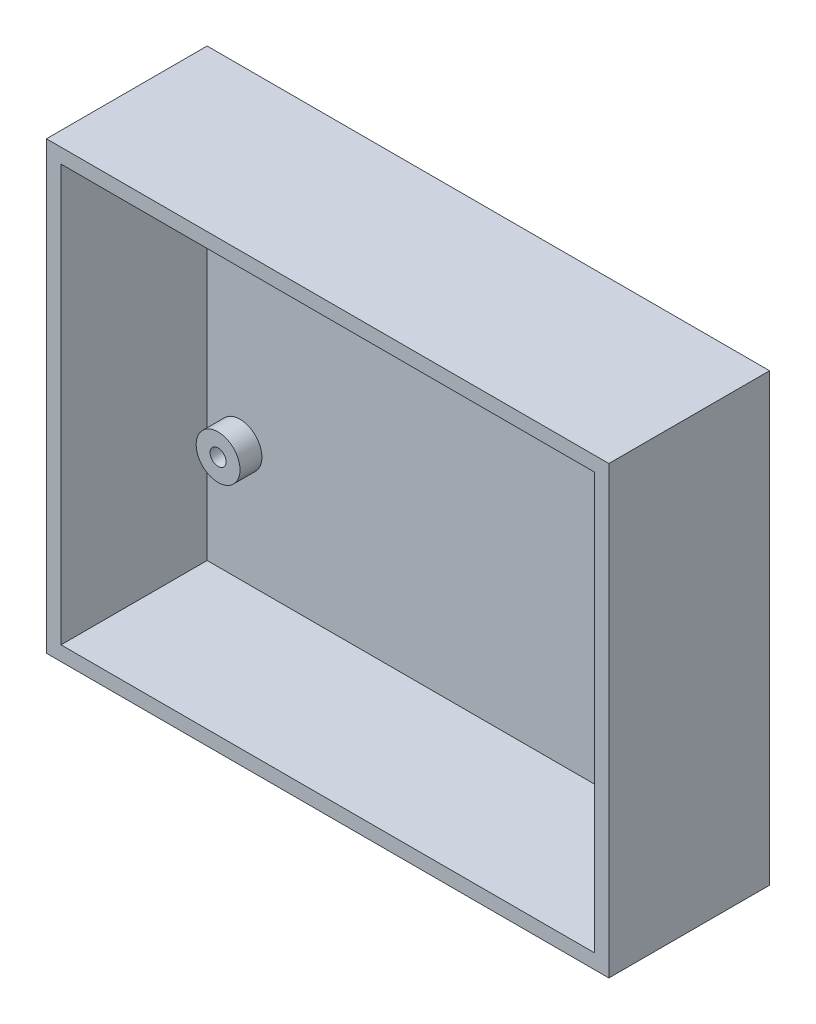
from build123d import *

# Parameters (mm, degrees)
SKETCH_1_W          = 77
SKETCH_1_H          = 61
EXTRUDE_1_DEPTH     = 22
SKETCH_2_W          = 73
SKETCH_2_H          = 57
CUT_EXTRUDE_1_DEPTH = 101.667770413
SKETCH_3_W          = 77
SKETCH_3_H          = 61
EXTRUDE_2_DEPTH     = 2
SKETCH_4_R          = 3
EXTRUDE_3_DEPTH     = 5
SKETCH_5_R          = 1.1
CUT_EXTRUDE_2_DEPTH = 101.667770413


with BuildPart() as part:
    # 草图1 → 凸台-拉伸1 (new body)
    with BuildSketch(Plane.XY):
        with Locations((38.5, 30.5)):
            Rectangle(SKETCH_1_W, SKETCH_1_H)
    extrude(amount=EXTRUDE_1_DEPTH)

    # 草图2 → 切除-拉伸1 (cut, through all)
    with BuildSketch(Plane.XY):
        with Locations((38.5, 30.5)):
            Rectangle(SKETCH_2_W, SKETCH_2_H)
    extrude(amount=CUT_EXTRUDE_1_DEPTH, mode=Mode.SUBTRACT)

    # 草图3 → 凸台-拉伸2 (add)
    with BuildSketch(Plane.XY):
        with Locations((38.5, 30.5)):
            Rectangle(SKETCH_3_W, SKETCH_3_H)
    extrude(amount=EXTRUDE_2_DEPTH)

    # 草图4 → 凸台-拉伸3 (add)
    with BuildSketch(Plane.XY):
        with Locations(Location((6.5, 18, 0), (0, 0, 180))):
            Circle(SKETCH_4_R)
        with Locations(Location((70.5, 18, 0), (0, 0, 180))):
            Circle(SKETCH_4_R)
        with Locations(Location((6.5, 54, 0), (0, 0, 180))):
            Circle(SKETCH_4_R)
        with Locations(Location((70.5, 54, 0), (0, 0, 180))):
            Circle(SKETCH_4_R)
    extrude(amount=EXTRUDE_3_DEPTH)

    # 草图5 → 切除-拉伸2 (cut, through all)
    with BuildSketch(Plane.XY):
        with Locations((6.5, 18)):
            Circle(SKETCH_5_R)
        with Locations((70.5, 18)):
            Circle(SKETCH_5_R)
        with Locations((6.5, 54)):
            Circle(SKETCH_5_R)
        with Locations((70.5, 54)):
            Circle(SKETCH_5_R)
    extrude(amount=CUT_EXTRUDE_2_DEPTH, mode=Mode.SUBTRACT)


solid = part.part
